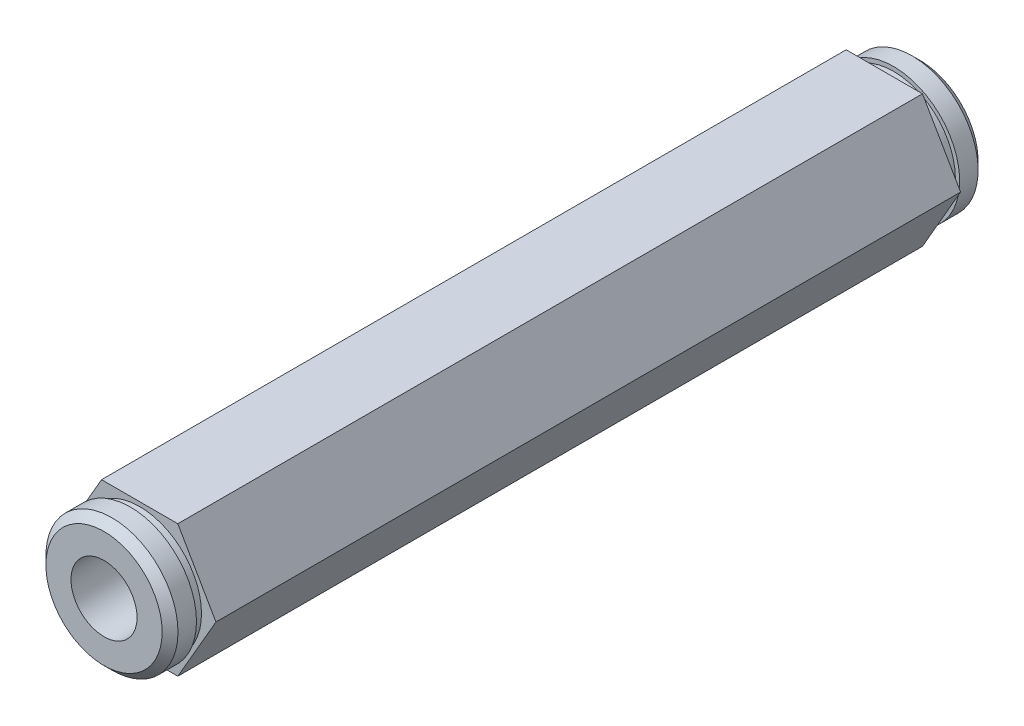
from build123d import *

# Parameters (mm, degrees)
BOSS_EXTRUDE1_DEPTH             = 14.2875
SKETCH2_R                       = 5.9436
BOSS_EXTRUDE2_DEPTH             = 0.889
SKETCH3_R                       = 6.35
BOSS_EXTRUDE3_DEPTH             = 2.54
CHAMFER1_SIZE                   = 0.762
BOSS_EXTRUDE4_DEPTH             = 43.0149
BOSS_EXTRUDE5_START             = 0.889
SKETCH6_R                       = 5.9436
BOSS_EXTRUDE5_DEPTH             = 0.889
BOSS_EXTRUDE6_START             = 2.54
SKETCH7_R                       = 6.35
BOSS_EXTRUDE6_DEPTH             = 2.54
CHAMFER2_SIZE                   = 0.762
F_1_4_0_25_DIAMETER_HOLE1_D     = 6.35
F_1_4_0_25_DIAMETER_HOLE1_DEPTH = 6.35
F_1_4_0_25_DIAMETER_HOLE1_TIP   = 1.907732465


with BuildPart() as part:
    # Sketch1 → Boss-Extrude1 (new, symmetric)
    with BuildSketch(Plane.XY):
        Polygon((7.332348419, 0), (3.666174209, 6.35), (-3.666174209, 6.35), (-7.332348419, 0), (-3.666174209, -6.35), (3.666174209, -6.35), align=None)
    extrude(amount=BOSS_EXTRUDE1_DEPTH, both=True)

    # Sketch2 → Boss-Extrude2 (add)
    with BuildSketch(Plane(origin=(0, 0, -14.2875), x_dir=(-1, 0, 0), z_dir=(0, 0, -1))):
        with Locations(Location((0, 0, 0), (0, 0, 180))):
            Circle(SKETCH2_R)
    extrude(amount=BOSS_EXTRUDE2_DEPTH)

    # Sketch3 → Boss-Extrude3 (add)
    with BuildSketch(Plane(origin=(0, 0, -15.1765), x_dir=(-1, 0, 0), z_dir=(0, 0, -1))):
        Circle(SKETCH3_R)
    extrude(amount=BOSS_EXTRUDE3_DEPTH)

    # Chamfer1
    chamfer1_edges = [part.edges().sort_by_distance(p)[0] for p in [
        (6.35, 0, -17.7165),
    ]]
    chamfer(chamfer1_edges, length=CHAMFER1_SIZE)

    # Sketch5 → Boss-Extrude4 (add)
    with BuildSketch(Plane.XY.offset(14.2875)):
        Polygon((3.666174209, 6.35), (-3.666174209, 6.35), (-7.332348419, 0), (-3.666174209, -6.35), (3.666174209, -6.35), (7.332348419, 0), align=None)
    extrude(amount=BOSS_EXTRUDE4_DEPTH)

    # Sketch6 → Boss-Extrude5 (add)
    with BuildSketch(Plane.XY.offset(57.3024).offset(BOSS_EXTRUDE5_START)):
        Circle(SKETCH6_R)
    extrude(amount=-BOSS_EXTRUDE5_DEPTH)

    # Sketch7 → Boss-Extrude6 (add)
    with BuildSketch(Plane.XY.offset(58.1914).offset(BOSS_EXTRUDE6_START)):
        with Locations(Location((0, 0, 0), (0, 0, 180))):
            Circle(SKETCH7_R)
    extrude(amount=-BOSS_EXTRUDE6_DEPTH)

    # Chamfer2
    chamfer2_edges = [part.edges().sort_by_distance(p)[0] for p in [
        (6.35, 0, 60.7314),
    ]]
    chamfer(chamfer2_edges, length=CHAMFER2_SIZE)

    # 1/4 (0.25) Diameter Hole1
    with Locations(Plane.XY.offset(60.7314)):
        with Locations((0, 0)):
            Hole(F_1_4_0_25_DIAMETER_HOLE1_D / 2, depth=F_1_4_0_25_DIAMETER_HOLE1_DEPTH)
            with Locations((0, 0, -(F_1_4_0_25_DIAMETER_HOLE1_DEPTH + F_1_4_0_25_DIAMETER_HOLE1_TIP / 2))):  # 118° drill point
                Cone(0, F_1_4_0_25_DIAMETER_HOLE1_D / 2, F_1_4_0_25_DIAMETER_HOLE1_TIP, mode=Mode.SUBTRACT)


solid = part.part
